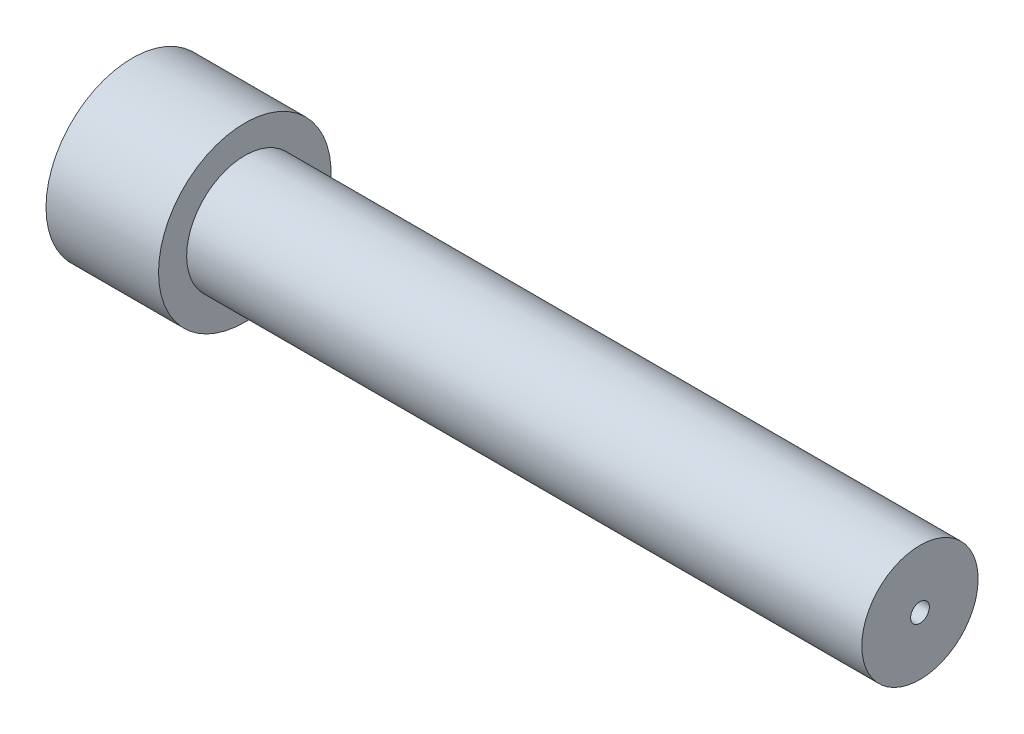
from build123d import *


with BuildPart() as part:
    # Sketch1 → Revolve1 (revolve)
    with BuildSketch(Plane.XY, mode=Mode.PRIVATE) as revolve1_sk:
        Polygon((0, 0), (0, 2.3), (3, 2.3), (3, 1.55), (21, 1.55), (21, 0.25), (16, 0.25), (16, 0), align=None)
    revolve(revolve1_sk.sketch.rotate(Axis((0, 0, 0), (1, 0, 0)), 90), axis=Axis((0, 0, 0), (1, 0, 0)))


solid = part.part
